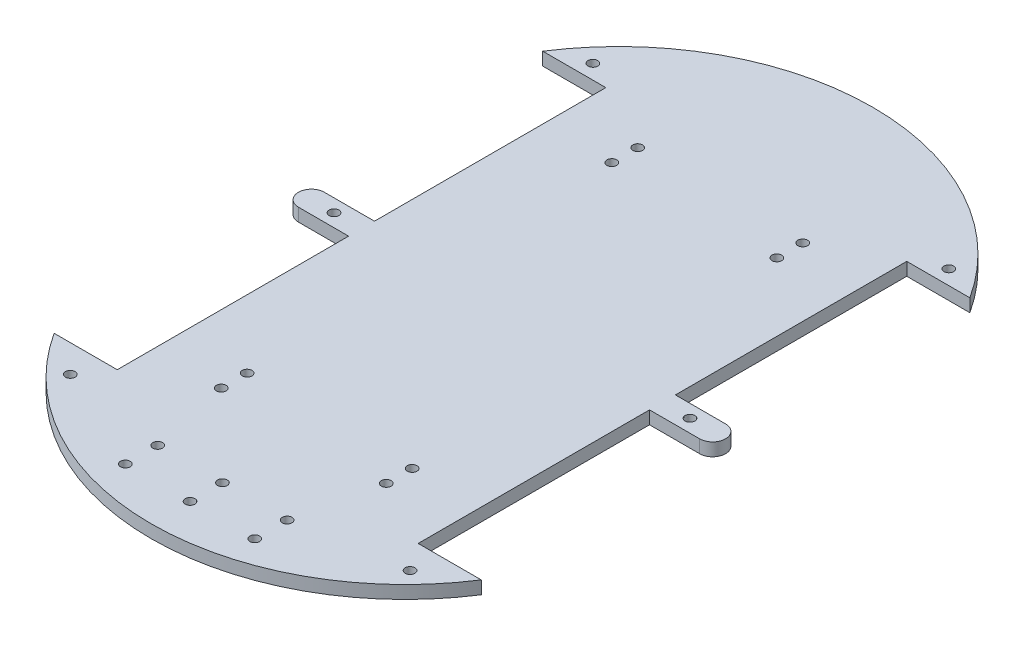
from build123d import *

# Parameters (mm, degrees)
PLATE_DEPTH             = 4
SKETCH2_R               = 1.5
PLATE_MOUNTINGS_DEPTH   = 130.631207662
SKETCH3_R               = 1.5
LIGHT_SENSOR_DEPTH      = 130.631207662
SKETCH4_R               = 1.5
CUT_EXTRUDE3_DEPTH      = 130.631207662
MIRROR2_COPY_1_SKETCH_R = 1.5
MIRROR2_COPY_1_DEPTH    = 130.631207662


with BuildPart() as part:
    # Sketch1 → Plate (new body)
    with BuildSketch(Plane(origin=(0, 0, 0), x_dir=(1, 0, 0), z_dir=(0, 1, 0))):
        with BuildLine():
            Line((62, 4), (46.5, 4))
            Line((46.5, 4), (46.5, 75.5))
            Line((46.5, 75.5), (66, 75.5))
            ThreePointArc((66, 75.5), (0, 111.5), (-66, 75.5))
            Line((-66, 75.5), (-46.5, 75.5))
            Line((-46.5, 75.5), (-46.5, 4))
            Line((-46.5, 4), (-62, 4))
            ThreePointArc((-62, 4), (-66, 0), (-62, -4))
            Line((-62, -4), (-46.5, -4))
            Line((-46.5, -4), (-46.5, -75.5))
            Line((-46.5, -75.5), (-66, -75.5))
            ThreePointArc((-66, -75.5), (0, -111.5), (66, -75.5))
            Line((66, -75.5), (46.5, -75.5))
            Line((46.5, -75.5), (46.5, -4))
            Line((46.5, -4), (62, -4))
            ThreePointArc((62, -4), (66, 0), (62, 4))
        make_face()
    extrude(amount=PLATE_DEPTH)

    # Sketch2 → Plate mountings (cut, through all)
    with BuildSketch(Plane(origin=(0, 4, 0), x_dir=(1, 0, 0), z_dir=(0, 1, 0))):
        with Locations(Location((55, 0, 0), (0, 0, 270))):
            Circle(SKETCH2_R)
        with Locations(Location((55, 80, 0), (0, 0, 270))):
            Circle(SKETCH2_R)
        with Locations(Location((-55, 0, 0), (0, 0, 90))):
            Circle(SKETCH2_R)
        with Locations(Location((-55, 80, 0), (0, 0, 90))):
            Circle(SKETCH2_R)
        with Locations(Location((52.5, -84, 0), (0, 0, 270))):
            Circle(SKETCH2_R)
        with Locations(Location((-52.5, -84, 0), (0, 0, 90))):
            Circle(SKETCH2_R)
    extrude(amount=-PLATE_MOUNTINGS_DEPTH, mode=Mode.SUBTRACT)

    # Sketch3 → Light sensor (cut, through all)
    with BuildSketch(Plane(origin=(0, 4, 0), x_dir=(1, 0, 0), z_dir=(0, 1, 0))):
        with Locations(Location((-20, -89.5, 0), (0, 0, 270))):
            Circle(SKETCH3_R)
        with Locations(Location((0, -89.5, 0), (0, 0, 270))):
            Circle(SKETCH3_R)
        with Locations(Location((20, -89.5, 0), (0, 0, 270))):
            Circle(SKETCH3_R)
        with Locations(Location((0, -99.5, 0), (0, 0, 270))):
            Circle(SKETCH3_R)
        with Locations(Location((20, -99.5, 0), (0, 0, 270))):
            Circle(SKETCH3_R)
        with Locations(Location((-20, -99.5, 0), (0, 0, 270))):
            Circle(SKETCH3_R)
    extrude(amount=-LIGHT_SENSOR_DEPTH, mode=Mode.SUBTRACT)

    # Sketch4 → Cut-Extrude3 (cut, through all)
    with BuildSketch(Plane(origin=(0, 4, 0), x_dir=(1, 0, 0), z_dir=(0, 1, 0))):
        with Locations(Location((25.5, 64.35, 0), (0, 0, 270))):
            Circle(SKETCH4_R)
        with Locations(Location((25.5, 56.35, 0), (0, 0, 270))):
            Circle(SKETCH4_R)
    cut_extrude3 = extrude(amount=-CUT_EXTRUDE3_DEPTH, mode=Mode.SUBTRACT)

    # Mirror1: Cut-Extrude3 across plane
    add(cut_extrude3.mirror(Plane(origin=(0, 0, 0), x_dir=(0, 0, 1), z_dir=(1, 0, 0))), mode=Mode.SUBTRACT)

    # Mirror2: Cut-Extrude3 across plane
    add(cut_extrude3.mirror(Plane.XY), mode=Mode.SUBTRACT)

    # Mirror2 copy 1 sketch → Mirror2 copy 1 (cut, through all)
    with BuildSketch(Plane(origin=(0, 4, 0), x_dir=(-1, 0, 0), z_dir=(0, 1, 0))):
        with Locations(Location((25.5, 64.35, 0), (0, 0, 270))):
            Circle(MIRROR2_COPY_1_SKETCH_R)
        with Locations(Location((25.5, 56.35, 0), (0, 0, 270))):
            Circle(MIRROR2_COPY_1_SKETCH_R)
    extrude(amount=-MIRROR2_COPY_1_DEPTH, mode=Mode.SUBTRACT)


solid = part.part
